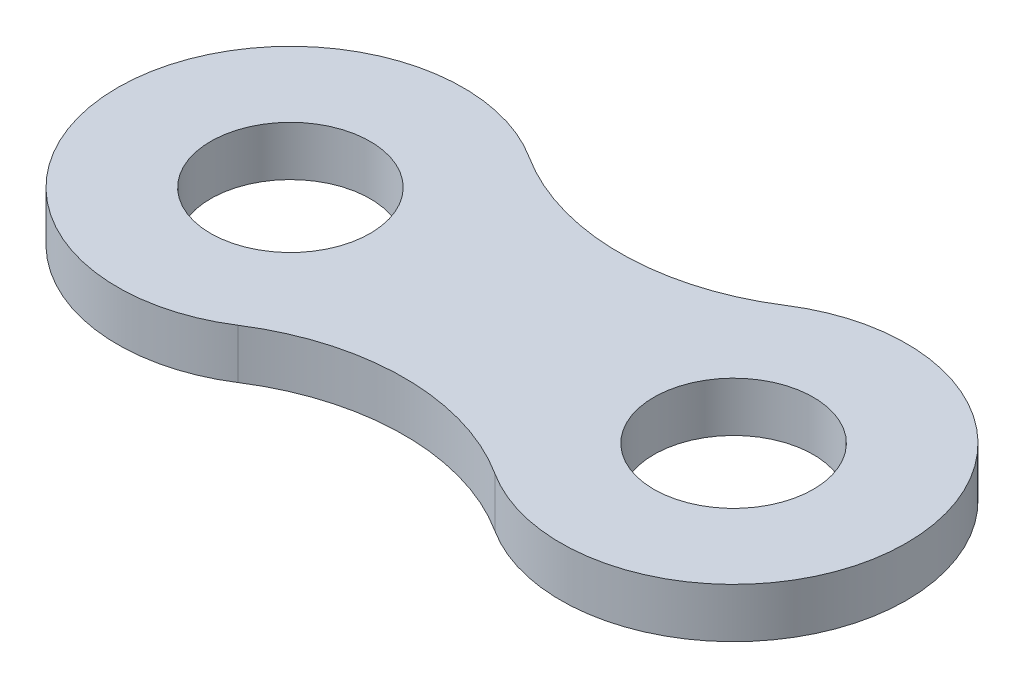
from build123d import *

# Parameters (mm, degrees)
SKETCH1_R           = 1.143
BOSS_EXTRUDE1_DEPTH = 0.7112


with BuildPart() as part:
    # Sketch1 → Boss-Extrude1 (new body)
    with BuildSketch(Plane(origin=(0, 0, 0), x_dir=(1, 0, 0), z_dir=(0, 1, 0))):
        with BuildLine():
            ThreePointArc((1.336483133, 2.084913688), (-2.4765, 0), (1.336483133, -2.084913688))
            ThreePointArc((1.336483133, -2.084913688), (3.175, -1.54623271), (5.013516867, -2.084913688))
            ThreePointArc((5.013516867, -2.084913688), (8.8265, 0), (5.013516867, 2.084913688))
            ThreePointArc((5.013516867, 2.084913688), (3.175, 1.54623271), (1.336483133, 2.084913688))
        make_face()
        with Locations(Location((0, 0, 0), (0, 0, 270))):
            Circle(SKETCH1_R, mode=Mode.SUBTRACT)
        with Locations(Location((6.35, 0, 0), (0, 0, 270))):
            Circle(SKETCH1_R, mode=Mode.SUBTRACT)
    extrude(amount=BOSS_EXTRUDE1_DEPTH)


solid = part.part
